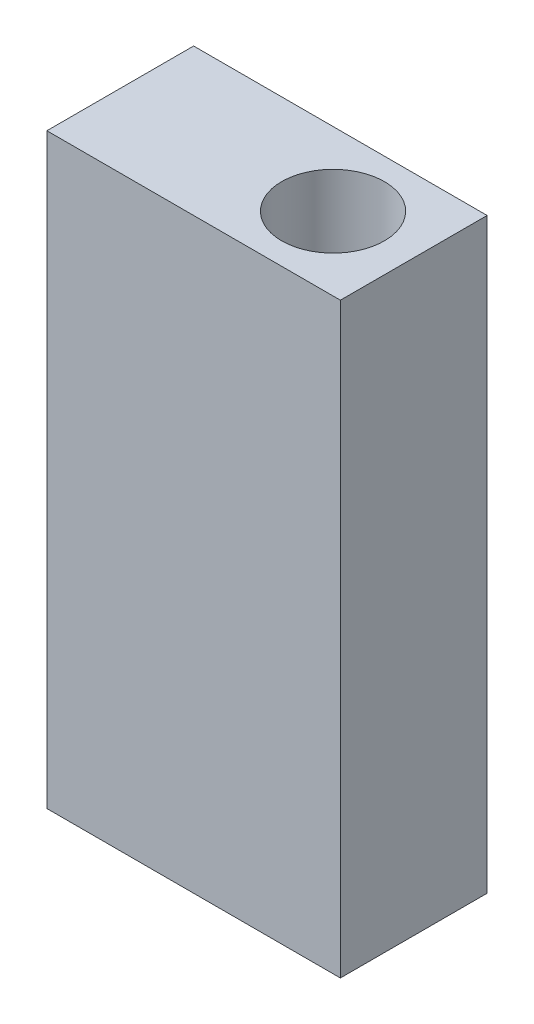
from build123d import *

# Parameters (mm, degrees)
SKETCH1_W           = 20
SKETCH1_H           = 10
SKETCH1_R           = 3.5
BOSS_EXTRUDE1_DEPTH = 40
SKETCH2_R           = 3.5
BOSS_EXTRUDE2_DEPTH = 10


with BuildPart() as part:
    # Sketch1 → Boss-Extrude1 (new body)
    with BuildSketch(Plane(origin=(0, 0, 0), x_dir=(1, 0, 0), z_dir=(0, 1, 0))):
        Rectangle(SKETCH1_W, SKETCH1_H)
        with Locations(Location((4.5, 0, 0), (0, 0, 270))):
            Circle(SKETCH1_R, mode=Mode.SUBTRACT)
    extrude(amount=BOSS_EXTRUDE1_DEPTH)

    # Sketch2 → Boss-Extrude2 (add)
    with BuildSketch(Plane(origin=(0, 0, 0), x_dir=(1, 0, 0), z_dir=(0, 1, 0))):
        with Locations(Location((4.5, 0, 0), (0, 0, 270))):
            Circle(SKETCH2_R)
    extrude(amount=BOSS_EXTRUDE2_DEPTH)


solid = part.part
